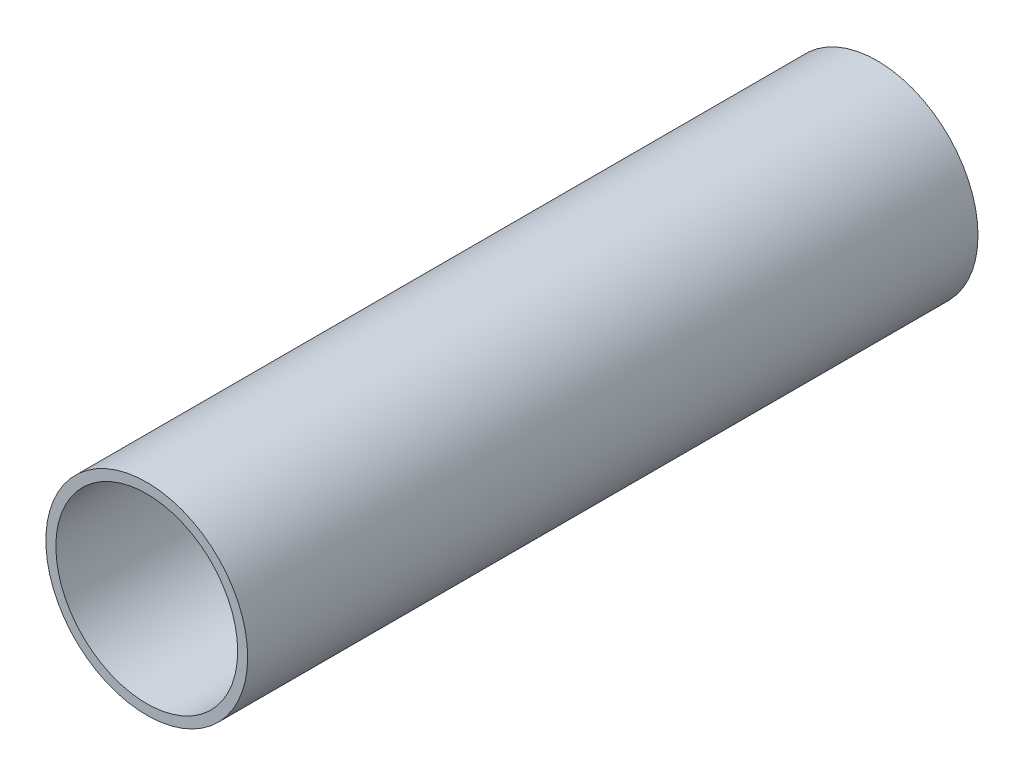
from build123d import *

# Parameters (mm, degrees)
SKETCH1_R           = 84.582
BOSS_EXTRUDE1_DEPTH = 306.07
SKETCH2_R           = 76.2
CUT_EXTRUDE1_DEPTH  = 612.14


with BuildPart() as part:
    # Sketch1 → Boss-Extrude1 (new, symmetric)
    with BuildSketch(Plane.XY):
        Circle(SKETCH1_R)
    extrude(amount=BOSS_EXTRUDE1_DEPTH, both=True)

    # Sketch2 → Cut-Extrude1 (cut)
    with BuildSketch(Plane.XY.offset(306.07)):
        Circle(SKETCH2_R)
    extrude(amount=-CUT_EXTRUDE1_DEPTH, mode=Mode.SUBTRACT)


solid = part.part
